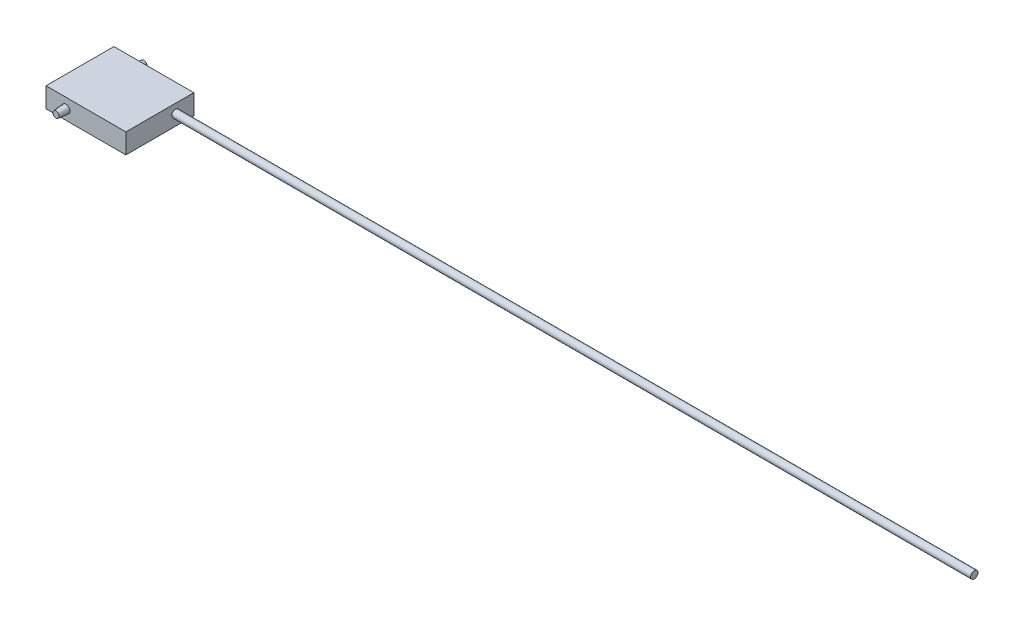
from build123d import *

# Parameters (mm, degrees)
SKETCH1_W           = 25.4
SKETCH1_H           = 21.59
BOSS_EXTRUDE1_DEPTH = 6.35
SKETCH2_R           = 1.27
BOSS_EXTRUDE2_DEPTH = 3.175
BOSS_EXTRUDE2_TAPER = 5
SKETCH3_R           = 1.169045739
BOSS_EXTRUDE3_DEPTH = 254


with BuildPart() as part:
    # Sketch1 → Boss-Extrude1 (new body)
    with BuildSketch(Plane(origin=(0, 0, 0), x_dir=(1, 0, 0), z_dir=(0, 1, 0))):
        Rectangle(SKETCH1_W, SKETCH1_H)
    extrude(amount=BOSS_EXTRUDE1_DEPTH)

    # Sketch2 → Boss-Extrude2 (add)
    with BuildSketch(Plane.XY.offset(10.795)):
        with Locations((-6.35, 3.175)):
            Circle(SKETCH2_R)
    boss_extrude2 = extrude(amount=BOSS_EXTRUDE2_DEPTH, taper=BOSS_EXTRUDE2_TAPER)

    # Mirror1: Boss-Extrude2 across plane
    add(boss_extrude2.mirror(Plane.XY))

    # Sketch3 → Boss-Extrude3 (add)
    with BuildSketch(Plane(origin=(12.7, 0, 0), x_dir=(0, 0, -1), z_dir=(1, 0, 0))):
        with Locations(Location((4.956387533, 3.55, 0), (0, 0, 180))):
            Circle(SKETCH3_R)
    extrude(amount=BOSS_EXTRUDE3_DEPTH)


solid = part.part
